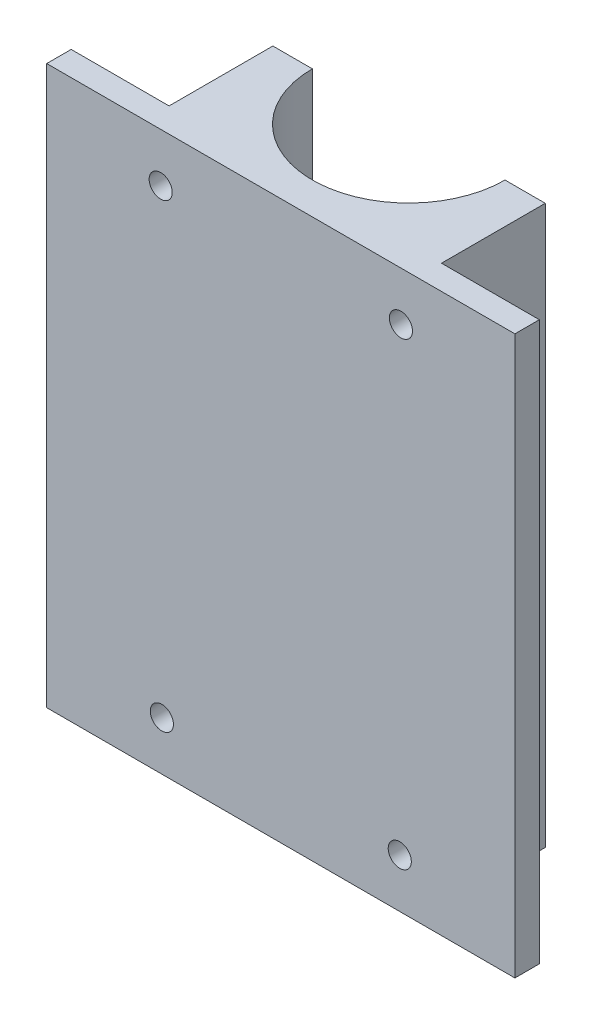
from build123d import *

# Parameters (mm, degrees)
BOSS_EXTRUDE3_DEPTH   = 72.39
BOSS_EXTRUDE4_DEPTH   = 51.39
F_3_0MM_DOWEL_HOLE4_D = 3


with BuildPart() as part:
    # Sketch1 → Boss-Extrude3 (new body)
    with BuildSketch(Plane(origin=(0, 0, 0), x_dir=(1, 0, 0), z_dir=(0, 1, 0))):
        with BuildLine():
            Line((-11.1466884, 17.698170271), (-23.8485284, 17.698170271))
            Line((-23.8485284, 17.698170271), (-23.8485284, 14.523170271))
            Line((-23.8485284, 14.523170271), (36.9033116, 14.523170271))
            Line((36.9033116, 14.523170271), (36.9033116, 17.698170271))
            Line((36.9033116, 17.698170271), (24.2033116, 17.698170271))
            Line((24.2033116, 17.698170271), (24.2033116, 31.16592192))
            Line((24.2033116, 31.16592192), (18.979662229, 31.16592192))
            ThreePointArc((18.979662229, 31.16592192), (6.479662229, 18.665921919), (-6.020337771, 31.16592192))
            Line((-6.020337771, 31.16592192), (-11.1466884, 31.16592192))
            Line((-11.1466884, 31.16592192), (-11.1466884, 17.698170271))
        make_face()
    extrude(amount=BOSS_EXTRUDE3_DEPTH)

    # Sketch1<13> → Boss-Extrude4 (add)
    with BuildSketch(Plane(origin=(0, 0, 0), x_dir=(1, 0, 0), z_dir=(0, 1, 0))):
        with BuildLine():
            Line((-6.020337771, 31.16592192), (-5.720337771, 31.16592192))
            ThreePointArc((-5.720337771, 31.16592192), (6.479662229, 18.965921919), (18.679662229, 31.16592192))
            Line((18.679662229, 31.16592192), (18.979662229, 31.16592192))
            ThreePointArc((18.979662229, 31.16592192), (6.479662229, 18.665921919), (-6.020337771, 31.16592192))
        make_face()
    extrude(amount=BOSS_EXTRUDE4_DEPTH)

    # Ø3.0mm Dowel Hole4 (through all)
    with Locations(Plane(origin=(0, 0, -31.16592192), x_dir=(-1, 0, 0), z_dir=(0, 0, -1))):
        with Locations((-22.1133116, 66.04), (9.0566884, 66.04), (8.9066884, 6.35), (-21.9633116, 6.35)):
            Hole(F_3_0MM_DOWEL_HOLE4_D / 2)


solid = part.part
